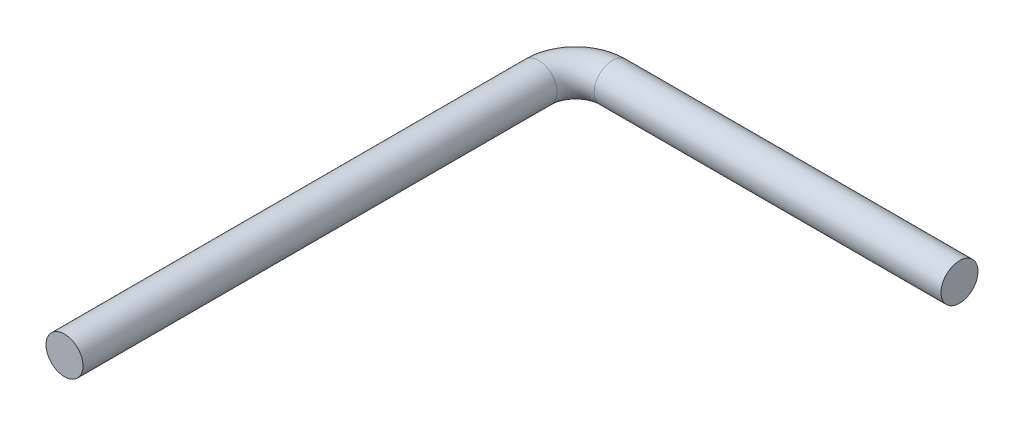
from build123d import *

# Parameters (mm, degrees)
SKETCH3_R = 1.27


with BuildPart() as part:
    # Sweep1: sweep along a path in Sketch1
    with BuildLine(Plane(origin=(0, 0, 0), x_dir=(1, 0, 0), z_dir=(0, 1, 0))) as sweep1_path:
        Line((7.891270042, 18.994850458), (-15.921229958, 18.994850458))
        ThreePointArc((-15.921229958, 18.994850458), (-17.717281182, 18.250901682), (-18.461229958, 16.454850458))
        Line((-18.461229958, 16.454850458), (-18.461229958, -16.087629542))
    # Sketch3 → Sweep1 (sweep)
    with BuildSketch(Plane(origin=(0, 0, 0), x_dir=(0, 0, -1), z_dir=(1, 0, 0))):
        with Locations((18.994850458, 0)):
            Circle(SKETCH3_R)
    sweep(path=sweep1_path.line)


solid = part.part
